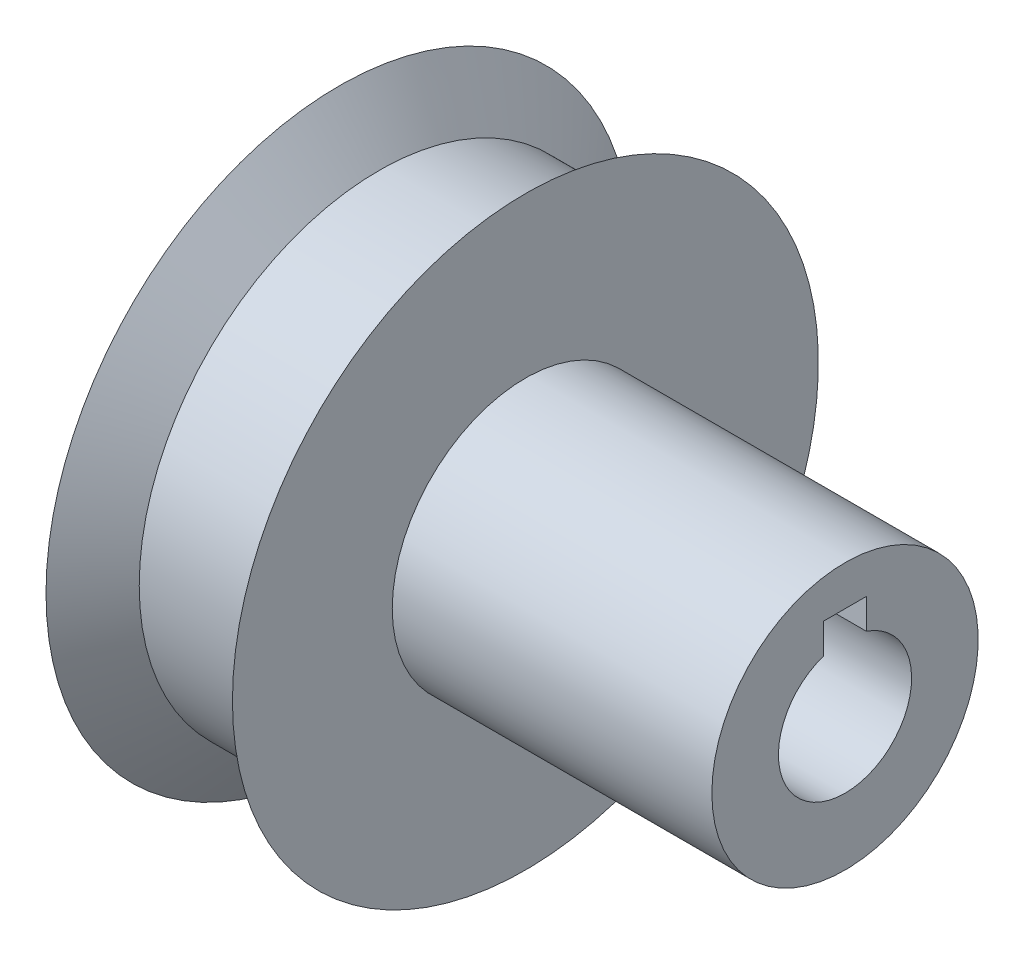
from build123d import *

# Parameters (mm, degrees)
CUT_EXTRUDE2_DEPTH = 123.780291578


with BuildPart() as part:
    # Sketch1 → Revolve1 (revolve)
    with BuildSketch(Plane(origin=(0, 0, 0), x_dir=(1, 0, 0), z_dir=(0, 1, 0)), mode=Mode.PRIVATE) as revolve1_sk:
        Polygon((95, 12.5), (95, 25), (35, 25), (35, 55), (28.060411696, 45), (7.5, 45), (0, 55), (0, 40), (25, 40), (25, 20), (50, 20), (50, 12.5), align=None)
    revolve(revolve1_sk.sketch.rotate(Axis((0, 0, 0), (1, 0, 0)), 180), axis=Axis((0, 0, 0), (1, 0, 0)))

    # Sketch3 → Cut-Extrude2 (cut, through all)
    with BuildSketch(Plane(origin=(95, 0, 0), x_dir=(0, 0, -1), z_dir=(1, 0, 0))):
        Polygon((0, 17.5), (-4, 17.5), (-4, 10.118492904), (4, 10.118492904), (4, 17.5), align=None)
    extrude(amount=-CUT_EXTRUDE2_DEPTH, mode=Mode.SUBTRACT)


solid = part.part
